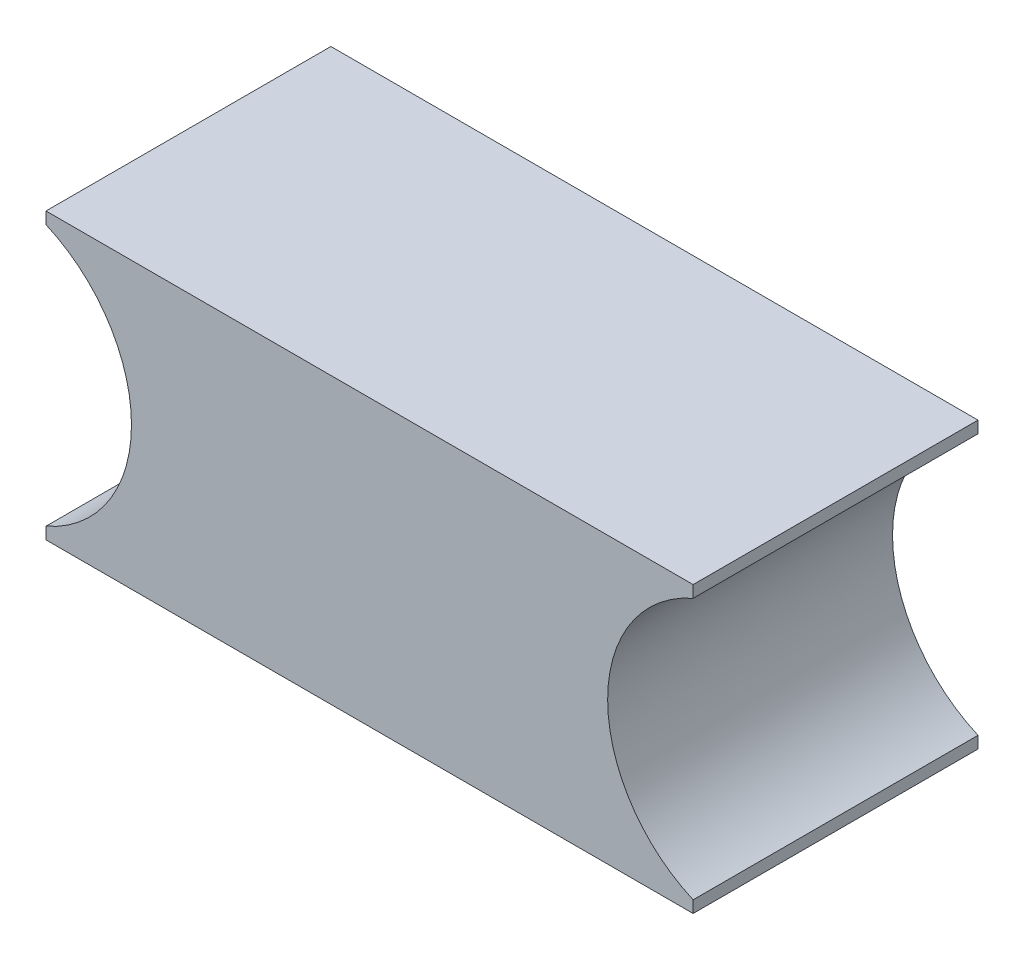
from build123d import *

# Parameters (mm, degrees)
BOSS_EXTRUDE2_DEPTH = 50.8


with BuildPart() as part:
    # Sketch4 → Boss-Extrude2 (new body)
    with BuildSketch(Plane.XY):
        with BuildLine():
            Line((-3.623552668, 25.4), (111.774314293, 25.4))
            Line((111.774314293, 25.4), (111.774314293, 23.27948453))
            ThreePointArc((111.774314293, 23.27948453), (96.534314293, 0), (111.774314293, -23.27948453))
            Line((111.774314293, -23.27948453), (111.774314293, -25.4))
            Line((111.774314293, -25.4), (-3.623552668, -25.4))
            Line((-3.623552668, -25.4), (-3.623552668, -23.27948453))
            ThreePointArc((-3.623552668, -23.27948453), (11.616447332, 0), (-3.623552668, 23.27948453))
            Line((-3.623552668, 23.27948453), (-3.623552668, 25.4))
        make_face()
    extrude(amount=BOSS_EXTRUDE2_DEPTH)


solid = part.part
